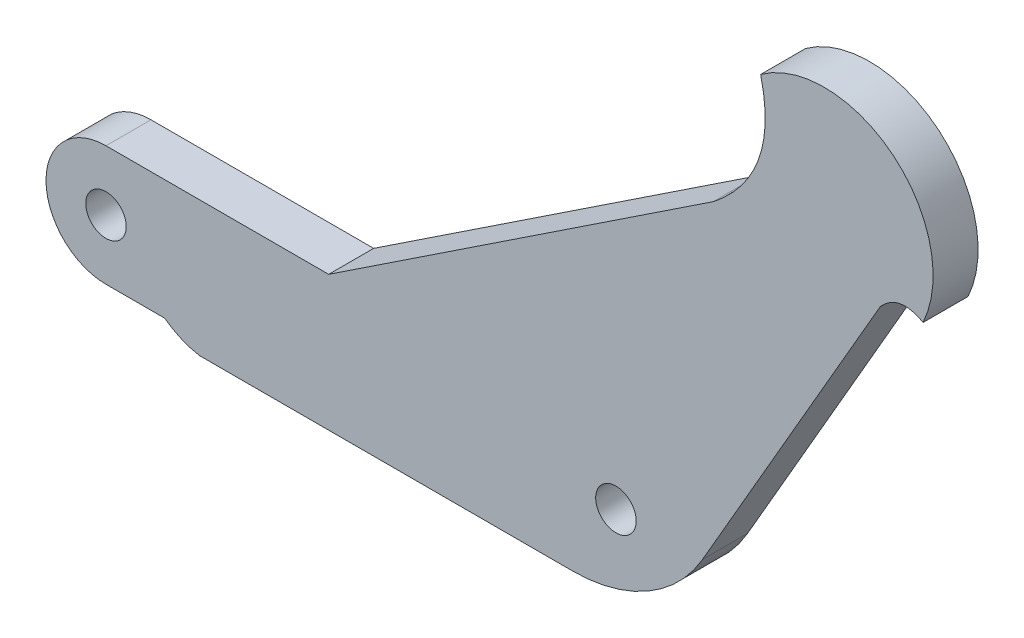
from build123d import *

# Parameters (mm, degrees)
SKETCH_1_R      = 1.35
EXTRUDE_2_DEPTH = 3


with BuildPart() as part:
    # 草图1 → 凸台-拉伸2 (new body)
    with BuildSketch(Plane.XY):
        with BuildLine():
            Line((6.226098023, -5), (31.113248654, -5))
            ThreePointArc((31.113248654, -5), (36.113248654, -3.660254038), (39.773502692, 0))
            Line((39.773502692, 0), (51.622883551, 20.523729686))
            add(Edge.make_bspline(
                [(51.622883551, 20.523729686), (52.87217552, 21.925402984), (54.475191511, 21.032727874)],
                knots=[0, 0, 0, 1, 1, 1], degree=2))
            ThreePointArc((54.475191511, 21.032727874), (52.505149262, 29.672890493), (43.647343513, 29.942619722))
            add(Edge.make_bspline(
                [(40.471851368, 21.005877846), (44.982527223, 24.526926475), (43.647343513, 29.942619722)],
                knots=[0, 0, 0, 1, 1, 1], degree=2))
            Line((40.471851368, 21.005877846), (14.846921247, 4))
            Line((14.846921247, 4), (0, 4))
            ThreePointArc((0, 4), (-4, 0), (0, -4))
            Line((0, -4), (3.908343777, -4))
            add(Edge.make_bspline(
                [(3.908343777, -4), (4.94861431, -4.76744043), (6.226098023, -5)],
                knots=[0, 0, 0, 1, 1, 1], degree=2))
        make_face()
        Circle(SKETCH_1_R, mode=Mode.SUBTRACT)
        with Locations((34, 0)):
            Circle(SKETCH_1_R, mode=Mode.SUBTRACT)
    extrude(amount=EXTRUDE_2_DEPTH)


solid = part.part
